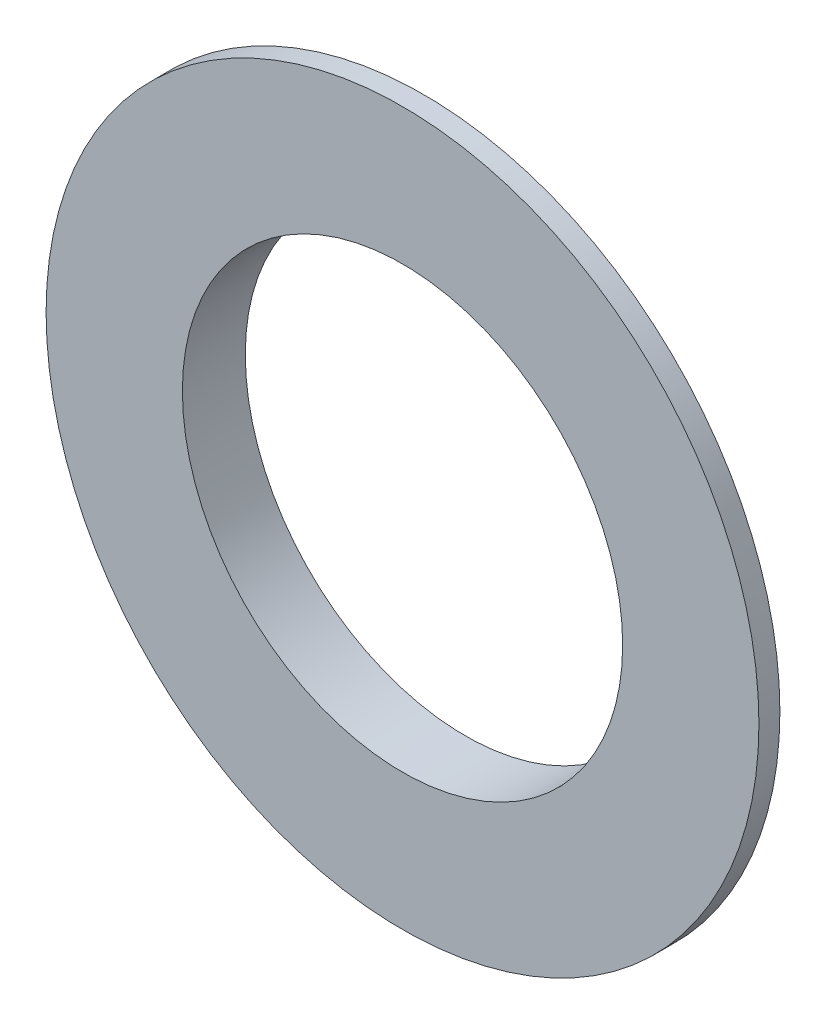
from build123d import *


with BuildPart() as part:
    # Sketch2 → Revolve1 (revolve)
    with BuildSketch(Plane(origin=(0, 0, 0), x_dir=(1, 0, 0), z_dir=(0, 1, 0))):
        Polygon((10.5, 0), (10.5, 3), (17, 1), (17, 0), align=None)
    revolve(axis=Axis((0, 0, 0), (0, 0, -1)))


solid = part.part
